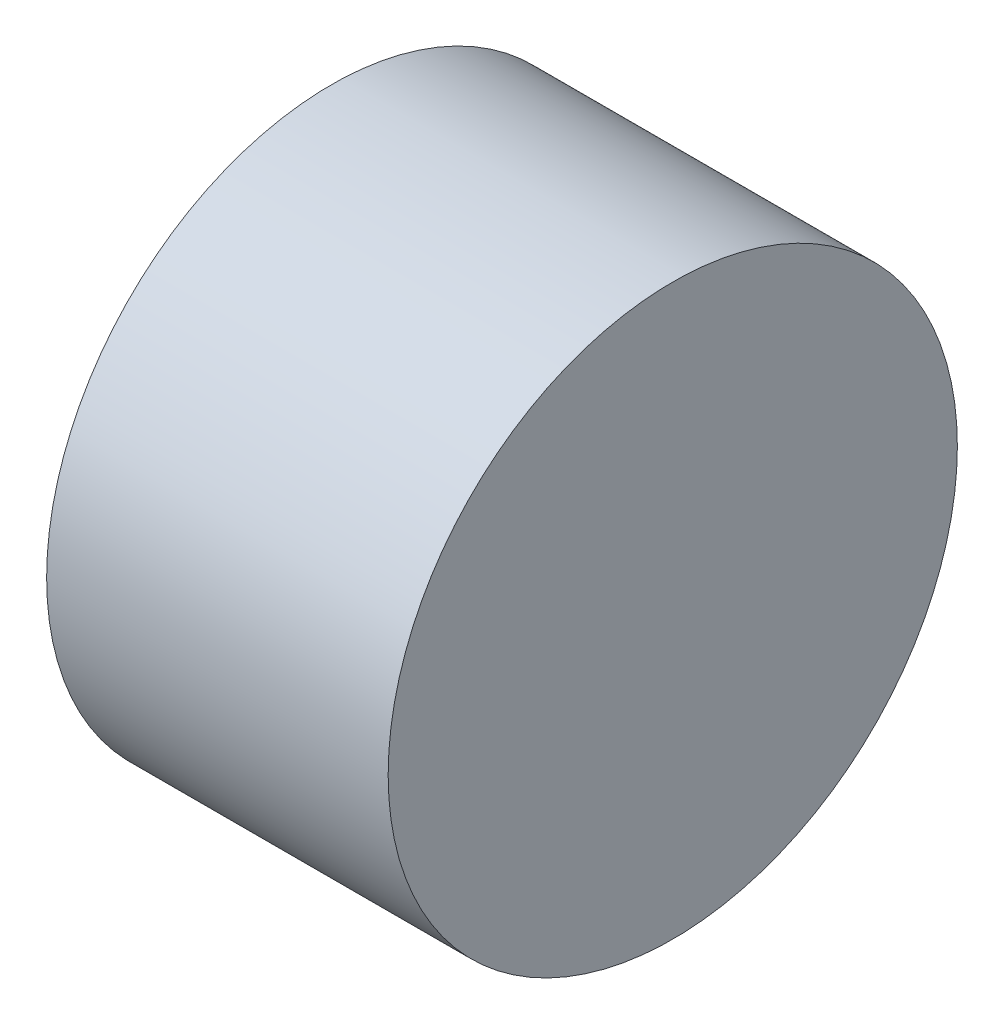
from build123d import *

# Parameters (mm, degrees)
SKETCH2_R               = 1.455
BOSS_EXTRUDE3_DEPTH     = 6
SKETCH3_R               = 2.5
BOSS_EXTRUDE4_DEPTH     = 3
CUT_EXTRUDE1_DEPTH      = 10.669539803
CUT_EXTRUDE1_DEPTH_BACK = 10.669539803
SKETCH4_R               = 0.5
SKETCH6_R               = 1.575
BOSS_EXTRUDE5_DEPTH     = 0.15
SKETCH8_R               = 1.455
CUT_EXTRUDE2_DEPTH      = 8
SKETCH10_R              = 3.334883887
CUT_EXTRUDE3_DEPTH      = 6.473774417
SKETCH11_R              = 1.456
CUT_EXTRUDE4_DEPTH      = 2


with BuildPart() as part:
    # Sketch2 → Boss-Extrude3 (new body)
    with BuildSketch(Plane(origin=(0, 0, 0), x_dir=(0, 0, -1), z_dir=(1, 0, 0))):
        Circle(SKETCH2_R)
    extrude(amount=BOSS_EXTRUDE3_DEPTH)

    # Sketch3 → Boss-Extrude4 (add)
    with BuildSketch(Plane(origin=(6, 0, 0), x_dir=(0, 0, -1), z_dir=(1, 0, 0))):
        Circle(SKETCH3_R)
    extrude(amount=BOSS_EXTRUDE4_DEPTH)

    # Sketch4 → Cut-Extrude1 (cut, two sides: drawn at the far end of the back side and taken through both)
    with BuildSketch(Plane(origin=(0, 0, 0), x_dir=(1, 0, 0), z_dir=(0, 1, 0)).offset(-CUT_EXTRUDE1_DEPTH_BACK)):
        with Locations(Location((3, 0, 0), (0, 0, 270))):
            Circle(SKETCH4_R)
    extrude(amount=CUT_EXTRUDE1_DEPTH + CUT_EXTRUDE1_DEPTH_BACK, mode=Mode.SUBTRACT)

    # Sketch6 → Boss-Extrude5 (add)
    with BuildSketch(Plane.ZY.offset(-3)):
        Circle(SKETCH6_R)
    extrude(amount=BOSS_EXTRUDE5_DEPTH)

    # Sketch7 → Revolve1 (revolve)
    with BuildSketch(Plane.XY, mode=Mode.PRIVATE) as revolve1_sk:
        Polygon((2.85, 1.825), (0, 0.8), (2.85, 0.8), align=None)
    revolve(revolve1_sk.sketch.rotate(Axis((9.45, 0, 0), (-1, 0, 0)), 90), axis=Axis((9.45, 0, 0), (-1, 0, 0)))

    # Sketch8 → Cut-Extrude2 (cut)
    with BuildSketch(Plane.ZY):
        with Locations(Location((0, 0, 0), (0, 0, 180))):
            Circle(SKETCH8_R)
    extrude(amount=-CUT_EXTRUDE2_DEPTH, mode=Mode.SUBTRACT)


with BuildPart() as cut_extrude2_piece_1:
    # of the separate pieces the step leaves, piece 1, a body of its own (cut_extrude2_pieces)
    add(part.part.solids().sort_by_distance((6, 0, -2.5))[0])

    # Sketch11 → Cut-Extrude4 (cut)
    with BuildSketch(Plane.ZY.offset(-6)):
        Circle(SKETCH11_R)
    extrude(amount=-CUT_EXTRUDE4_DEPTH, mode=Mode.SUBTRACT)


with BuildPart() as cut_extrude2_piece_2:
    # of the separate pieces the step leaves, piece 2, a body of its own (cut_extrude2_pieces)
    add(part.part.solids().sort_by_distance((3, 0, 1.575))[0])

    # Sketch10 → Cut-Extrude3 (cut, through all)
    with BuildSketch(Plane.ZY.offset(-6)):
        Circle(SKETCH10_R)
    extrude(amount=CUT_EXTRUDE3_DEPTH, mode=Mode.SUBTRACT)


solid = cut_extrude2_piece_1.part
